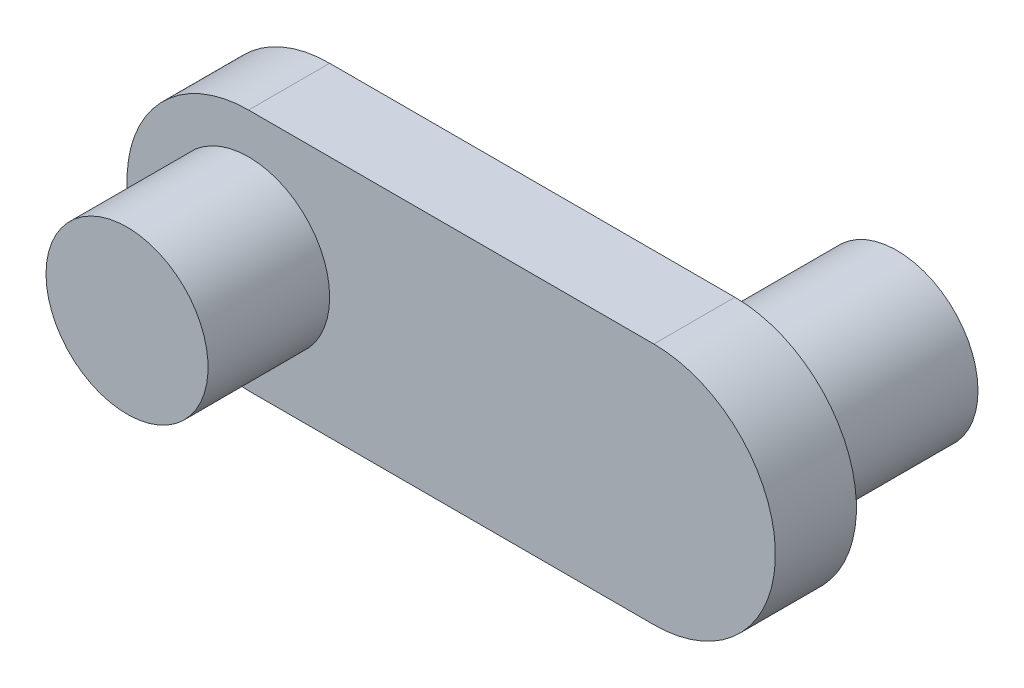
from build123d import *

# Parameters (mm, degrees)
SKETCH1_R           = 10
BOSS_EXTRUDE1_DEPTH = 10
BOSS_EXTRUDE2_START = -30
SKETCH2_R           = 10
BOSS_EXTRUDE2_DEPTH = 30
SKETCH3_R           = 10
BOSS_EXTRUDE3_DEPTH = 25


with BuildPart() as part:
    # Sketch1 → Boss-Extrude1 (new body)
    with BuildSketch(Plane.XY):
        with BuildLine():
            Line((-95.01107872, 15), (-45.01107872, 15))
            ThreePointArc((-45.01107872, 15), (-30.01107872, 0), (-45.01107872, -15))
            Line((-45.01107872, -15), (-95.01107872, -15))
            ThreePointArc((-95.01107872, -15), (-110.01107872, 0), (-95.01107872, 15))
        make_face()
        with Locations((-95.01107872, 0)):
            Circle(SKETCH1_R, mode=Mode.SUBTRACT)
        with Locations((-45.01107872, 0)):
            Circle(SKETCH1_R, mode=Mode.SUBTRACT)
    extrude(amount=BOSS_EXTRUDE1_DEPTH)

    # Sketch2 → Boss-Extrude2 (add)
    with BuildSketch(Plane.XY.offset(10).offset(BOSS_EXTRUDE2_START)):
        with Locations((-45.01107872, 0)):
            Circle(SKETCH2_R)
    extrude(amount=BOSS_EXTRUDE2_DEPTH)

    # Sketch3 → Boss-Extrude3 (add)
    with BuildSketch(Plane(origin=(0, 0, 0), x_dir=(-1, 0, 0), z_dir=(0, 0, -1))):
        with Locations((95.01107872, 0)):
            Circle(SKETCH3_R)
    extrude(amount=-BOSS_EXTRUDE3_DEPTH)


solid = part.part
